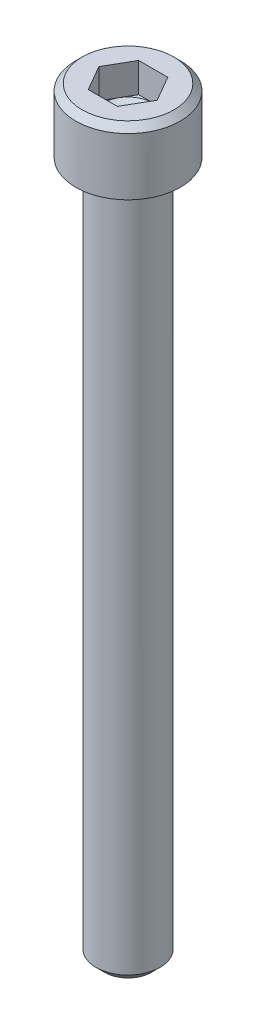
from build123d import *

# Parameters (mm, degrees)
SKETCH1_W           = 2.8702
SKETCH1_H           = 3.5052
SKETCH2_R           = 1.7526
BOSS_EXTRUDE1_DEPTH = 38.1
CUT_EXTRUDE1_DEPTH  = 1.6256
CHAMFER1_SIZE       = 0.47244
CHAMFER2_SIZE       = 0.3556
FILLET1_R           = 0.254


with BuildPart() as part:
    # Sketch1 → Revolve1 (revolve)
    with BuildSketch(Plane.XY, mode=Mode.PRIVATE) as revolve1_sk:
        with Locations((1.4351, 1.7526)):
            Rectangle(SKETCH1_W, SKETCH1_H)
    revolve(revolve1_sk.sketch.rotate(Axis((0, 3.5052, 0), (0, -1, 0)), 270), axis=Axis((0, 3.5052, 0), (0, -1, 0)))

    # Sketch2 → Boss-Extrude1 (add)
    with BuildSketch(Plane.XZ):
        with Locations(Location((0, 0, 0), (0, 0, 90))):
            Circle(SKETCH2_R)
    extrude(amount=BOSS_EXTRUDE1_DEPTH)

    # Sketch3 → Cut-Extrude1 (cut)
    with BuildSketch(Plane(origin=(0, 3.5052, 0), x_dir=(-1, 0, 0), z_dir=(0, 1, 0))):
        Polygon((-0.799225978, 1.3843), (-1.598451955, 0), (-0.799225978, -1.3843), (0.799225978, -1.3843), (1.598451955, 0), (0.799225978, 1.3843), align=None)
    extrude(amount=-CUT_EXTRUDE1_DEPTH, mode=Mode.SUBTRACT)

    # Sketch4 → Cut-Revolve1 (revolve, cut)
    with BuildSketch(Plane.XY, mode=Mode.PRIVATE) as cut_revolve1_sk:
        Polygon((1.3843, 1.8796), (0, 1.8796), (0, 1.080374022), align=None)
    revolve(cut_revolve1_sk.sketch.rotate(Axis((0, 1.879625, 0), (0, -1, 0)), 90), axis=Axis((0, 1.879625, 0), (0, -1, 0)), mode=Mode.SUBTRACT)

    # Chamfer1
    chamfer1_edges = [part.edges().sort_by_distance(p)[0] for p in [
        (0, -38.1, -1.7526),
    ]]
    chamfer(chamfer1_edges, length=CHAMFER1_SIZE)

    # Chamfer2
    chamfer2_edges = [part.edges().sort_by_distance(p)[0] for p in [
        (0, 3.5052, 2.8702),
    ]]
    chamfer(chamfer2_edges, length=CHAMFER2_SIZE)

    # Fillet1
    fillet1_edges = [part.edges().sort_by_distance(p)[0] for p in [
        (0, 0, -1.7526),
    ]]
    fillet(fillet1_edges, radius=FILLET1_R)


solid = part.part
